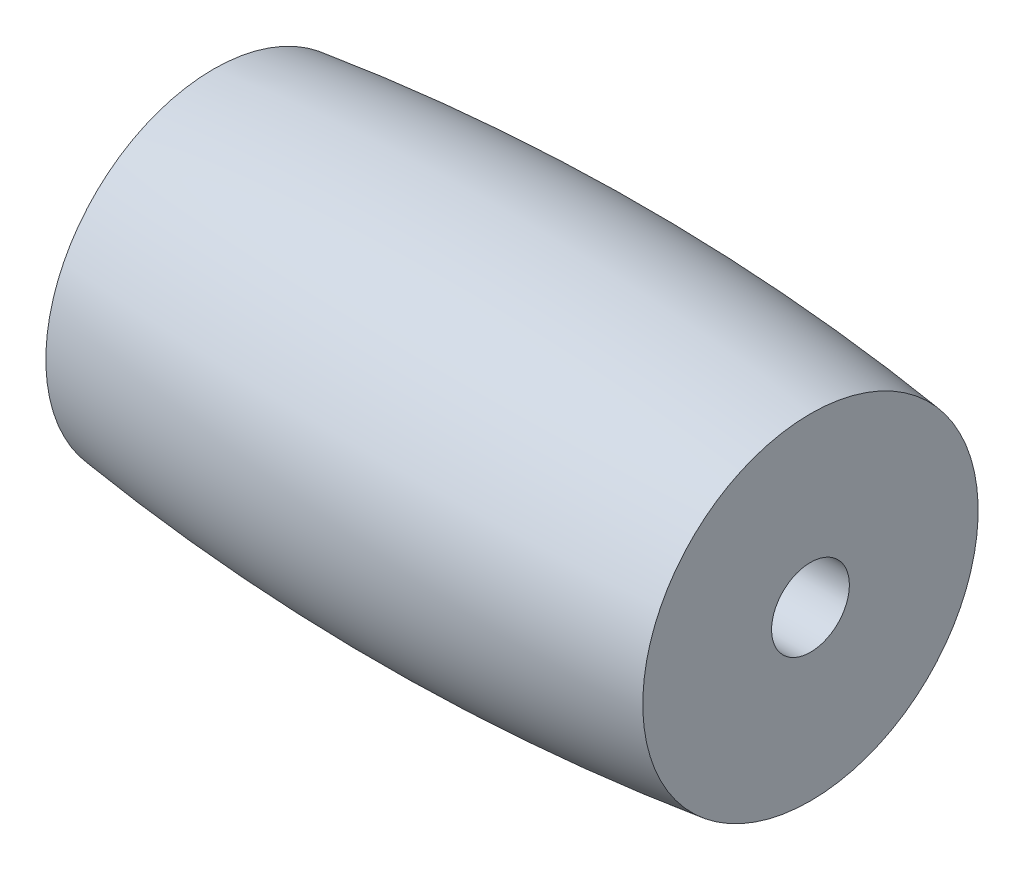
from build123d import *


with BuildPart() as part:
    # Sketch2 → Revolve1 (revolve)
    with BuildSketch(Plane.XY):
        with BuildLine():
            Line((5.6515, 0.7366), (5.6515, 3.175))
            ThreePointArc((5.6515, 3.175), (0, 3.5306), (-5.6515, 3.175))
            Line((-5.6515, 3.175), (-5.6515, 0.7366))
            Line((-5.6515, 0.7366), (5.6515, 0.7366))
        make_face()
    revolve(axis=Axis((0, 0, 0), (-1, 0, 0)))


solid = part.part
